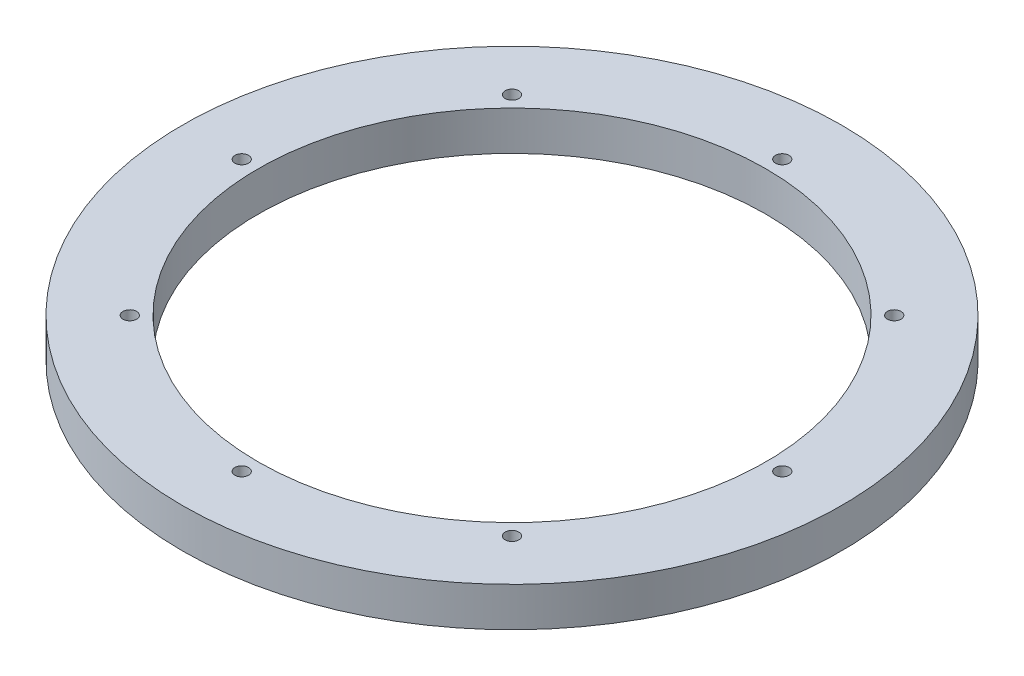
from build123d import *

# Parameters (mm, degrees)
SKETCH1_R           = 63.881
SKETCH1_R_2         = 49.2125
SKETCH1_R_3         = 1.3208
BOSS_EXTRUDE1_DEPTH = 7.62


with BuildPart() as part:
    # Sketch1 → Boss-Extrude1 (new body)
    with BuildSketch(Plane(origin=(0, 0, 0), x_dir=(1, 0, 0), z_dir=(0, 1, 0))):
        with Locations(Location((0, 0, 0), (0, 0, 90))):
            Circle(SKETCH1_R)
        with Locations(Location((0, 0, 0), (0, 0, 90))):
            Circle(SKETCH1_R_2, mode=Mode.SUBTRACT)
        with Locations(Location((0, -52.3875, 0), (0, 0, 90))):
            Circle(SKETCH1_R_3, mode=Mode.SUBTRACT)
        with Locations(Location((-37.043556499, -37.043556499, 0), (0, 0, 90))):
            Circle(SKETCH1_R_3, mode=Mode.SUBTRACT)
        with Locations(Location((-52.3875, 0, 0), (0, 0, 90))):
            Circle(SKETCH1_R_3, mode=Mode.SUBTRACT)
        with Locations(Location((-37.043556499, 37.043556499, 0), (0, 0, 90))):
            Circle(SKETCH1_R_3, mode=Mode.SUBTRACT)
        with Locations(Location((0, 52.3875, 0), (0, 0, 90))):
            Circle(SKETCH1_R_3, mode=Mode.SUBTRACT)
        with Locations(Location((37.043556499, 37.043556499, 0), (0, 0, 90))):
            Circle(SKETCH1_R_3, mode=Mode.SUBTRACT)
        with Locations(Location((52.3875, 0, 0), (0, 0, 90))):
            Circle(SKETCH1_R_3, mode=Mode.SUBTRACT)
        with Locations(Location((37.043556499, -37.043556499, 0), (0, 0, 90))):
            Circle(SKETCH1_R_3, mode=Mode.SUBTRACT)
    extrude(amount=BOSS_EXTRUDE1_DEPTH)


solid = part.part
